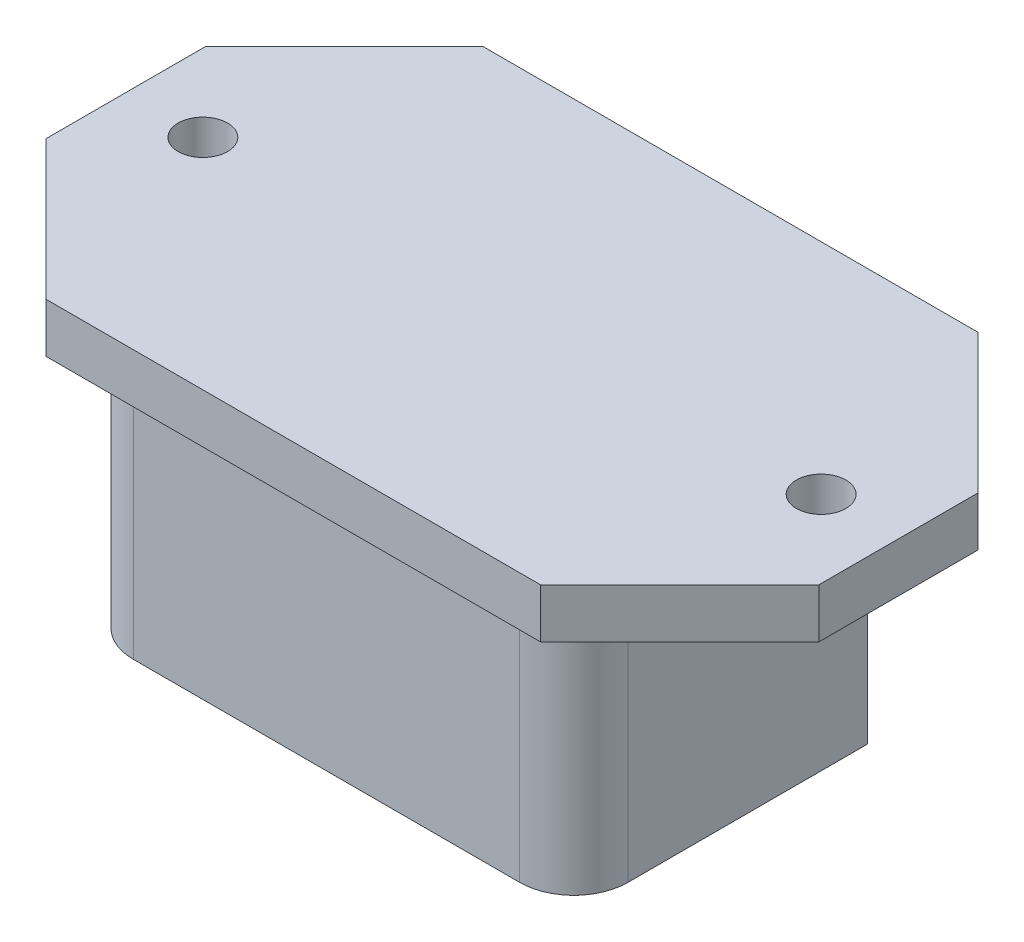
from build123d import *

# Parameters (mm, degrees)
SKETCH1_W           = 32
SKETCH1_H           = 24
BOSS_EXTRUDE1_DEPTH = 16.3
SKETCH2_W           = 50
SKETCH2_H           = 28.3
BOSS_EXTRUDE2_DEPTH = 3.2
FILLET1_R           = 3.5
CHAMFER1_SIZE       = 5
CHAMFER2_SIZE       = 9
SKETCH3_R           = 1.6
CUT_EXTRUDE1_DEPTH  = 3.2


with BuildPart() as part:
    # Sketch1 → Boss-Extrude1 (new body)
    with BuildSketch(Plane(origin=(0, 0, 0), x_dir=(1, 0, 0), z_dir=(0, 1, 0))):
        Rectangle(SKETCH1_W, SKETCH1_H)
    extrude(amount=BOSS_EXTRUDE1_DEPTH)

    # Sketch2 → Boss-Extrude2 (add)
    with BuildSketch(Plane(origin=(0, 16.3, 0), x_dir=(1, 0, 0), z_dir=(0, 1, 0))):
        Rectangle(SKETCH2_W, SKETCH2_H)
    extrude(amount=BOSS_EXTRUDE2_DEPTH)

    # Fillet1
    fillet1_edges = [part.edges().sort_by_distance(p)[0] for p in [
        (16, 8.15, 12),
        (-16, 8.15, 12),
    ]]
    fillet(fillet1_edges, radius=FILLET1_R)

    # Chamfer1
    chamfer1_edges = [part.edges().sort_by_distance(p)[0] for p in [
        (-16, 8.15, -12),
        (16, 8.15, -12),
    ]]
    chamfer(chamfer1_edges, length=CHAMFER1_SIZE)

    # Chamfer2
    chamfer2_edges = [part.edges().sort_by_distance(p)[0] for p in [
        (25, 17.9, 14.15),
        (25, 17.9, -14.15),
        (-25, 17.9, -14.15),
        (-25, 17.9, 14.15),
    ]]
    chamfer(chamfer2_edges, length=CHAMFER2_SIZE)

    # Sketch3 → Cut-Extrude1 (cut)
    with BuildSketch(Plane(origin=(0, 19.5, 0), x_dir=(1, 0, 0), z_dir=(0, 1, 0))):
        with Locations(Location((-20, 0, 0), (0, 0, 270))):
            Circle(SKETCH3_R)
        with Locations(Location((20, 0, 0), (0, 0, 90))):
            Circle(SKETCH3_R)
    extrude(amount=-CUT_EXTRUDE1_DEPTH, mode=Mode.SUBTRACT)


solid = part.part
